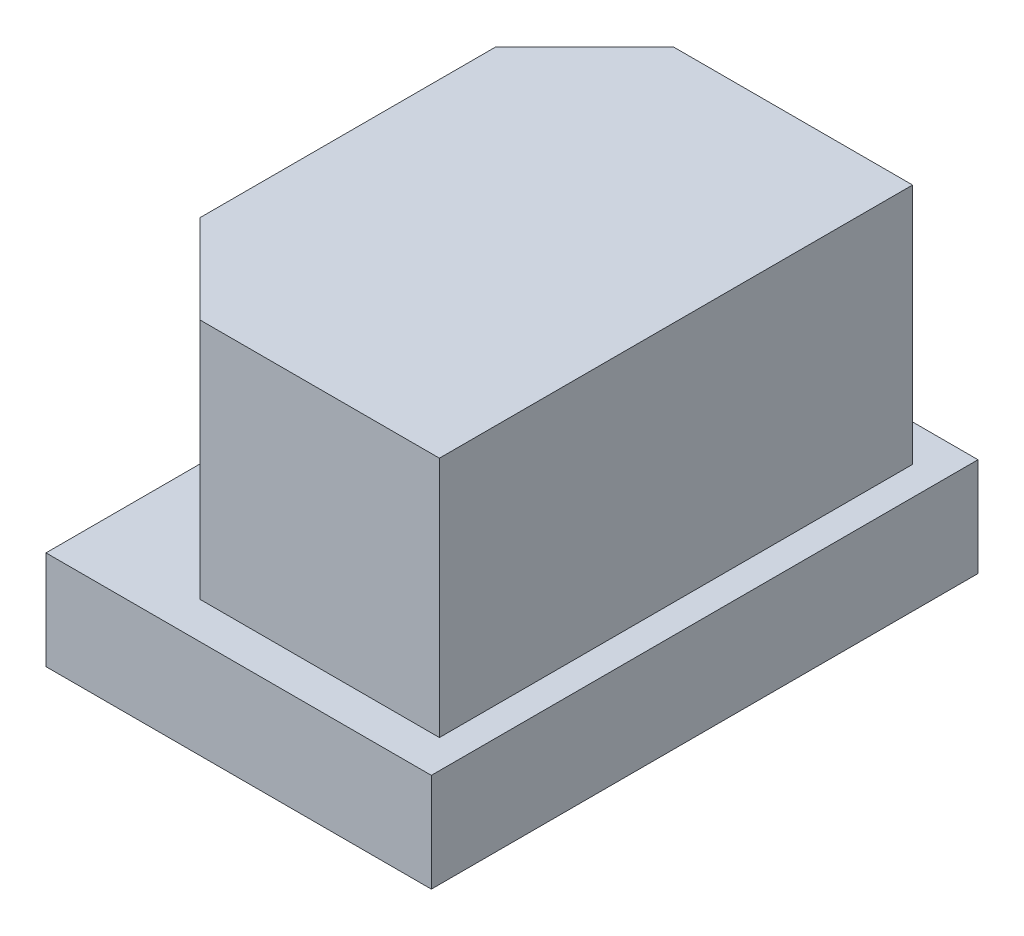
from build123d import *

# Parameters (mm, degrees)
BOSS_EXTRUDE1_DEPTH = 13.5
SKETCH2_W           = 21.5
SKETCH2_H           = 30.5
BOSS_EXTRUDE2_DEPTH = 5.5


with BuildPart() as part:
    # Sketch1 → Boss-Extrude1 (new body)
    with BuildSketch(Plane(origin=(0, 0, 0), x_dir=(1, 0, 0), z_dir=(0, 1, 0))):
        Polygon((-13.350252532, -26.4), (-18.3, -21.450252532), (-18.3, -4.949747468), (-13.350252532, 0), (0, 0), (0, -26.4), align=None)
    extrude(amount=BOSS_EXTRUDE1_DEPTH)

    # Sketch2 → Boss-Extrude2 (add)
    with BuildSketch(Plane.XZ):
        with Locations((-9.15, 13.2)):
            Rectangle(SKETCH2_W, SKETCH2_H)
    extrude(amount=BOSS_EXTRUDE2_DEPTH)


solid = part.part
